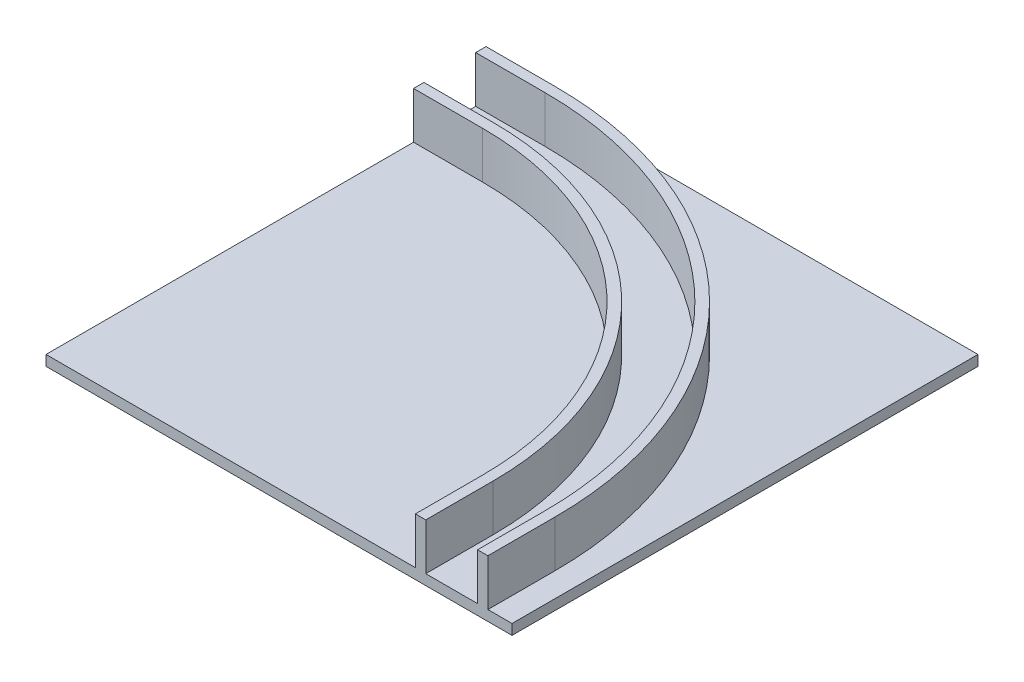
from build123d import *

# Parameters (mm, degrees)
SKETCH_1_W      = 90
SKETCH_1_H      = 90
EXTRUDE_1_DEPTH = 2
EXTRUDE_5_DEPTH = 9


with BuildPart() as part:
    # 草图1 → 凸台-拉伸1 (new body)
    with BuildSketch(Plane(origin=(0, 0, 0), x_dir=(1, 0, 0), z_dir=(0, 1, 0))):
        Rectangle(SKETCH_1_W, SKETCH_1_H)
    extrude(amount=EXTRUDE_1_DEPTH)

    # 草图2 → 拉伸-薄壁5 (add)
    with BuildSketch(Plane(origin=(0, 2, 0), x_dir=(1, 0, 0), z_dir=(0, 1, 0))):
        with BuildLine():
            Line((40.343110101, -45), (40.343110101, -32.015885558))
            ThreePointArc((40.343110101, -32.015885558), (19.254798346, 18.895802688), (-31.656889899, 39.984114442))
            Line((-31.656889899, 39.984114442), (-45, 39.984114442))
            Line((-45, 39.984114442), (-45, 37.984114442))
            Line((-45, 37.984114442), (-31.656889899, 37.984114442))
            ThreePointArc((-31.656889899, 37.984114442), (17.840584784, 17.481589125), (38.343110101, -32.015885558))
            Line((38.343110101, -32.015885558), (38.343110101, -45))
            Line((38.343110101, -45), (40.343110101, -45))
        make_face()
        with BuildLine():
            Line((28.343110101, -45), (28.343110101, -32.015885558))
            ThreePointArc((28.343110101, -32.015885558), (10.769516972, 10.410521313), (-31.656889899, 27.984114442))
            Line((-31.656889899, 27.984114442), (-45, 27.984114442))
            Line((-45, 27.984114442), (-45, 25.984114442))
            Line((-45, 25.984114442), (-31.656889899, 25.984114442))
            ThreePointArc((-31.656889899, 25.984114442), (9.35530341, 8.996307751), (26.343110101, -32.015885558))
            Line((26.343110101, -32.015885558), (26.343110101, -45))
            Line((26.343110101, -45), (28.343110101, -45))
        make_face()
    extrude(amount=EXTRUDE_5_DEPTH)


solid = part.part
